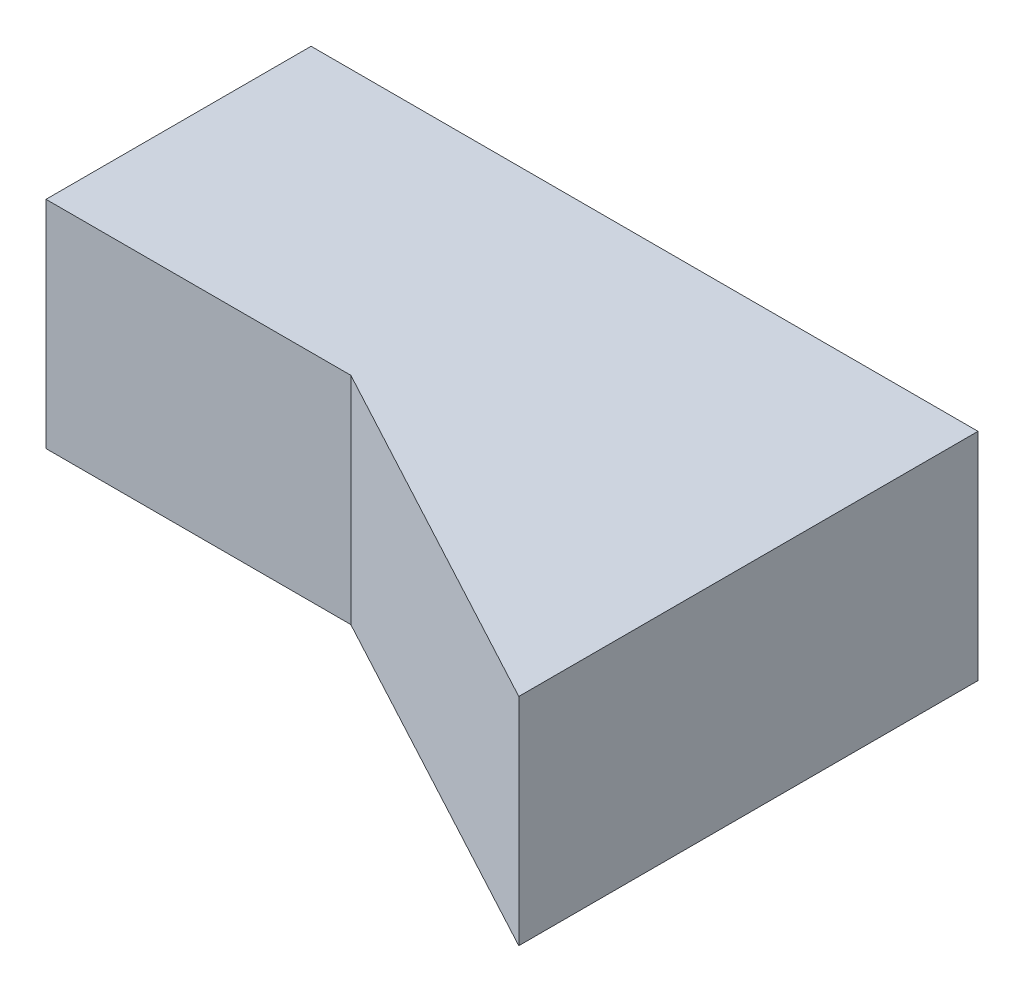
from build123d import *

# Parameters (mm, degrees)
BOSS_EXTRUDE2_DEPTH = 413.766


with BuildPart() as part:
    # Sketch1 → Boss-Extrude2 (new body)
    with BuildSketch(Plane(origin=(0, 0, 0), x_dir=(1, 0, 0), z_dir=(0, 1, 0))):
        Polygon((0, 0), (-584.2, 0), (-584.2, 508), (693.938338156, 508), (693.938338156, -372.086472258), align=None)
    extrude(amount=BOSS_EXTRUDE2_DEPTH)


solid = part.part
